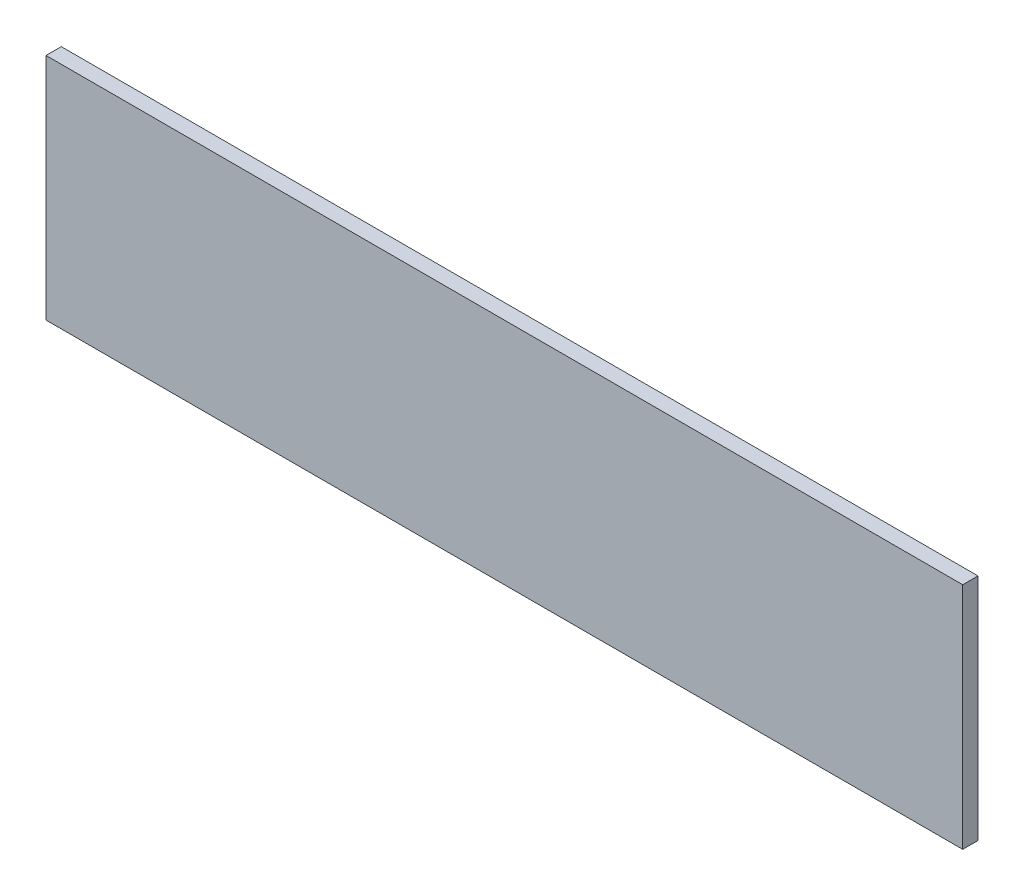
from build123d import *

# Parameters (mm, degrees)
SCHIZZO1_W                   = 120
SCHIZZO1_H                   = 30
ESTRUSIONE_ESTRUSIONE1_DEPTH = 2


with BuildPart() as part:
    # Schizzo1 → Estrusione-Estrusione1 (new body)
    with BuildSketch(Plane.XY):
        with Locations((60, 15)):
            Rectangle(SCHIZZO1_W, SCHIZZO1_H)
    extrude(amount=ESTRUSIONE_ESTRUSIONE1_DEPTH)


solid = part.part
